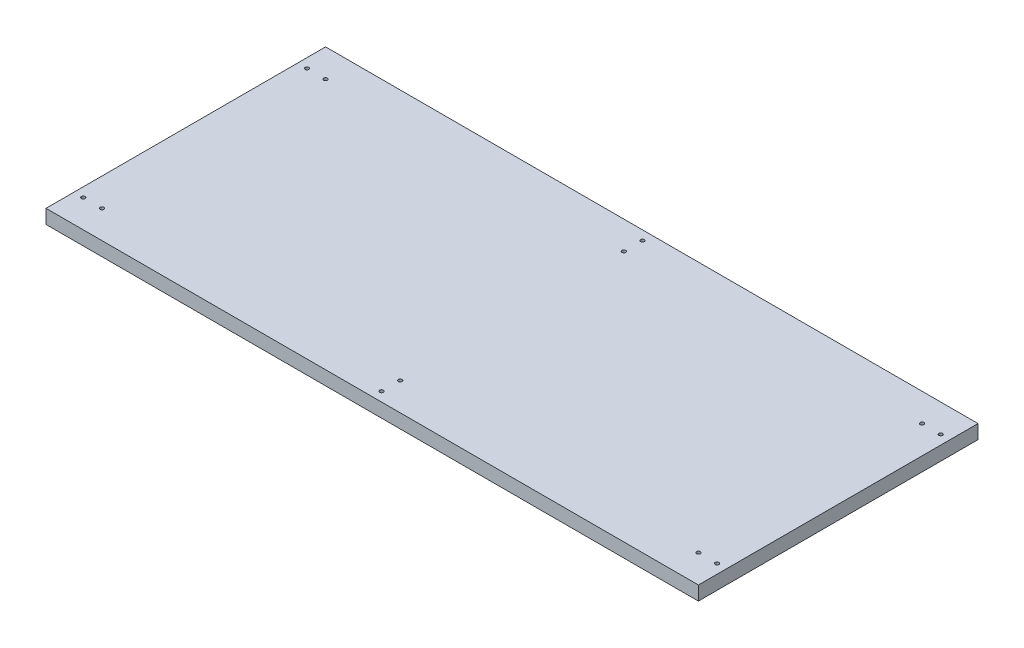
from build123d import *

# Parameters (mm, degrees)
CROQUIS1_W              = 700
CROQUIS1_H              = 300
SALIENTE_EXTRUIR1_DEPTH = 15
CROQUIS2_R              = 2
CORTAR_EXTRUIR1_DEPTH   = 10


with BuildPart() as part:
    # Croquis1 → Saliente-Extruir1 (new body)
    with BuildSketch(Plane(origin=(0, 0, 0), x_dir=(1, 0, 0), z_dir=(0, 1, 0))):
        Rectangle(CROQUIS1_W, CROQUIS1_H)
    extrude(amount=SALIENTE_EXTRUIR1_DEPTH)

    # Croquis2 → Cortar-Extruir1 (cut)
    with BuildSketch(Plane(origin=(0, 15, 0), x_dir=(1, 0, 0), z_dir=(0, 1, 0))):
        with Locations(Location((-320, 120, 0), (0, 0, 270))):
            Circle(CROQUIS2_R)
        with Locations(Location((-320, -120, 0), (0, 0, 270))):
            Circle(CROQUIS2_R)
        with Locations(Location((320, 120, 0), (0, 0, 270))):
            Circle(CROQUIS2_R)
        with Locations(Location((320, -120, 0), (0, 0, 270))):
            Circle(CROQUIS2_R)
        with Locations(Location((0, -120, 0), (0, 0, 270))):
            Circle(CROQUIS2_R)
        with Locations(Location((0, 120, 0), (0, 0, 270))):
            Circle(CROQUIS2_R)
        with Locations(Location((-340, -120, 0), (0, 0, 270))):
            Circle(CROQUIS2_R)
        with Locations(Location((-340, 120, 0), (0, 0, 270))):
            Circle(CROQUIS2_R)
        with Locations(Location((0, -140, 0), (0, 0, 270))):
            Circle(CROQUIS2_R)
        with Locations(Location((0, 140, 0), (0, 0, 270))):
            Circle(CROQUIS2_R)
        with Locations(Location((340, -120, 0), (0, 0, 270))):
            Circle(CROQUIS2_R)
        with Locations(Location((340, 120, 0), (0, 0, 270))):
            Circle(CROQUIS2_R)
    extrude(amount=-CORTAR_EXTRUIR1_DEPTH, mode=Mode.SUBTRACT)


solid = part.part
